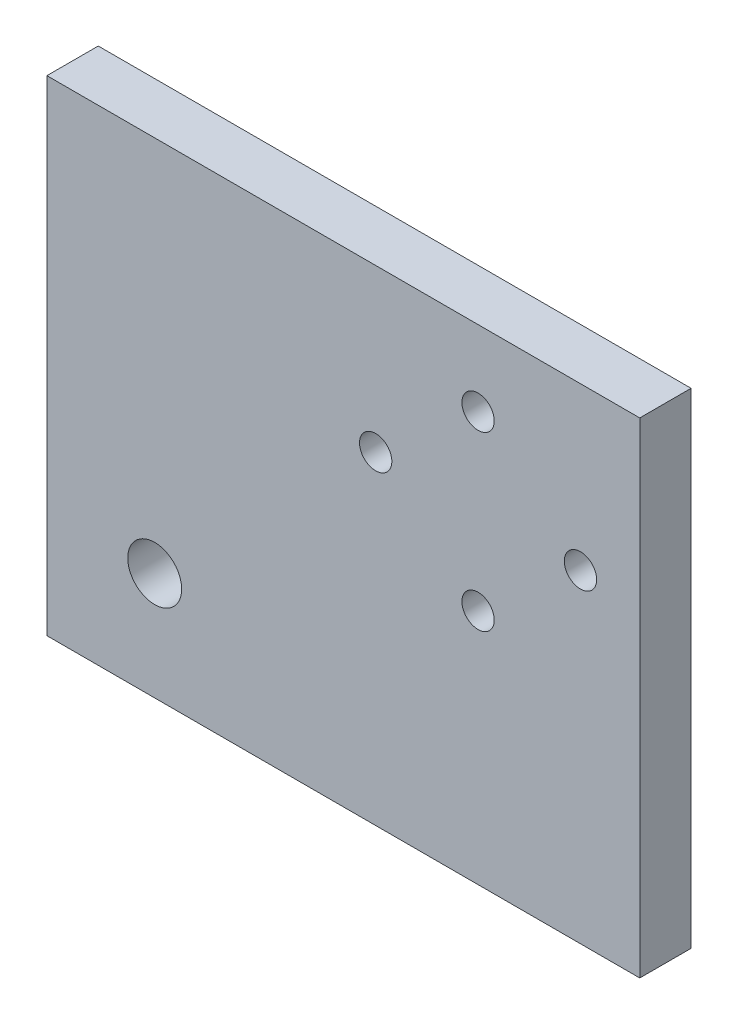
from build123d import *

# Parameters (mm, degrees)
SKETCH1_W           = 55
SKETCH1_H           = 45
SKETCH1_R           = 2.5
SKETCH1_R_2         = 1.5
BOSS_EXTRUDE1_DEPTH = 4.7625


with BuildPart() as part:
    # Sketch1 → Boss-Extrude1 (new body)
    with BuildSketch(Plane.XY):
        with Locations((27.5, 22.5)):
            Rectangle(SKETCH1_W, SKETCH1_H)
        with Locations(Location((10, 10, 0), (0, 0, 180))):
            Circle(SKETCH1_R, mode=Mode.SUBTRACT)
        with Locations(Location((30.5, 30, 0), (0, 0, 180))):
            Circle(SKETCH1_R_2, mode=Mode.SUBTRACT)
        with Locations(Location((49.5, 30, 0), (0, 0, 180))):
            Circle(SKETCH1_R_2, mode=Mode.SUBTRACT)
        with Locations(Location((40, 38, 0), (0, 0, 180))):
            Circle(SKETCH1_R_2, mode=Mode.SUBTRACT)
        with Locations(Location((40, 22, 0), (0, 0, 180))):
            Circle(SKETCH1_R_2, mode=Mode.SUBTRACT)
    extrude(amount=BOSS_EXTRUDE1_DEPTH)


solid = part.part
